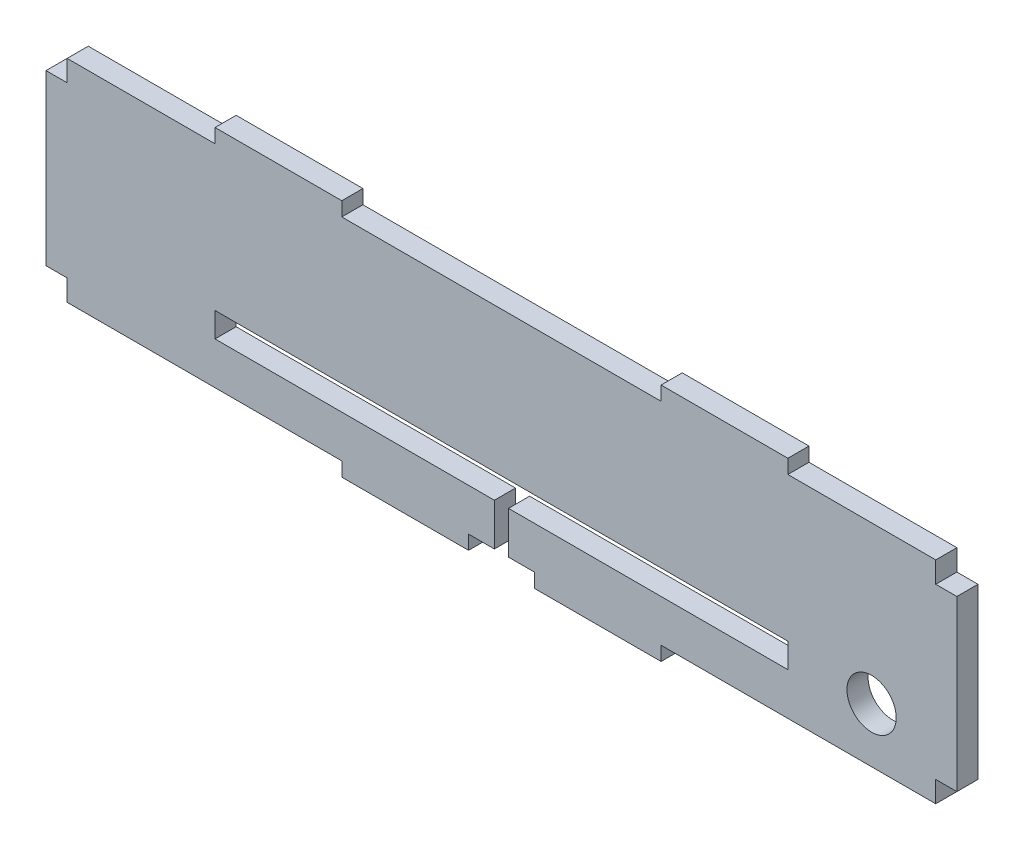
from build123d import *

# Parameters (mm, degrees)
SKETCH1_R           = 3.5
BOSS_EXTRUDE3_DEPTH = 3


with BuildPart() as part:
    # Sketch1 → Boss-Extrude3 (new body)
    with BuildSketch(Plane.XY):
        Polygon((3, 3), (3, 0), (42, 0), (42, -2), (60, -2), (60, 0), (63.67, 0), (63.67, 6), (24, 6), (24, 9.5), (105.34, 9.5), (105.34, 6), (65.67, 6), (65.67, 0), (69.34, 0), (69.34, -2), (87.34, -2), (87.34, 0), (126.34, 0), (126.34, 3), (129.34, 3), (129.34, 27), (126.34, 27), (126.34, 30), (105.34, 30), (105.34, 32), (87.34, 32), (87.34, 30), (42, 30), (42, 32), (24, 32), (24, 30), (3, 30), (3, 27), (0, 27), (0, 3), align=None)
        with Locations((117.228803839, 7.75)):
            Circle(SKETCH1_R, mode=Mode.SUBTRACT)
    extrude(amount=BOSS_EXTRUDE3_DEPTH)


solid = part.part
